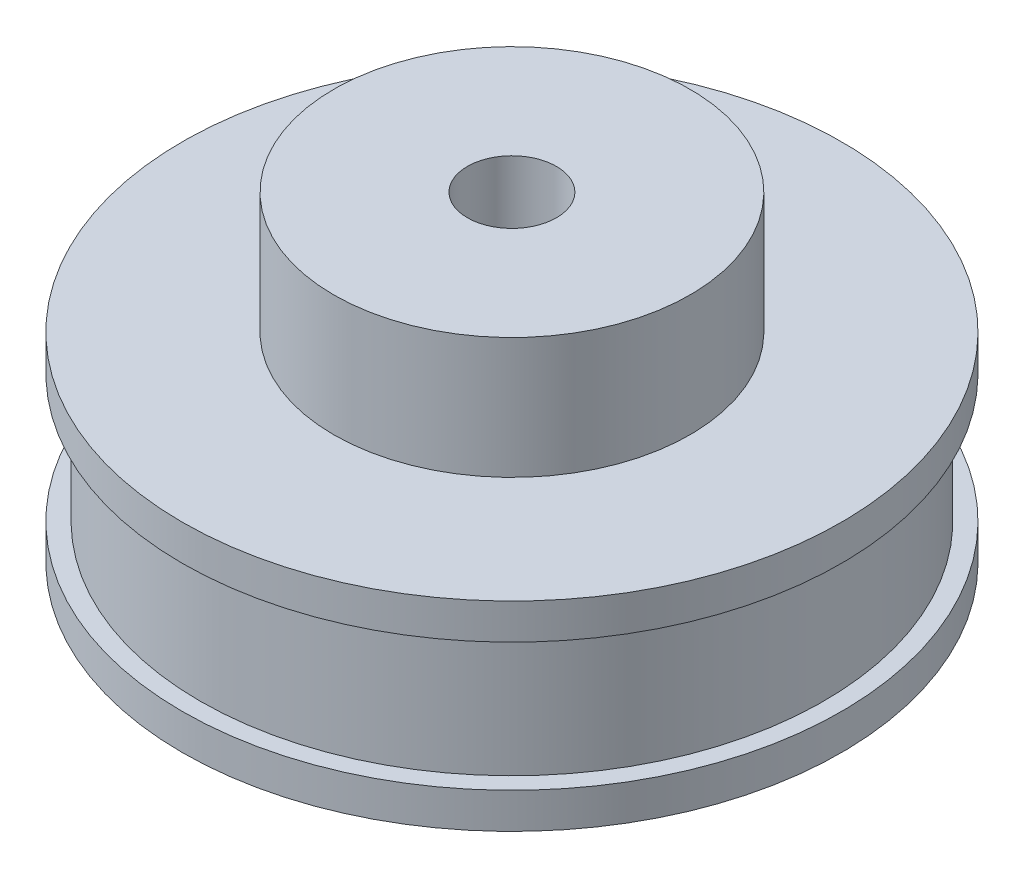
from build123d import *

# Parameters (mm, degrees)
SKIZZE1_R                       = 18.5
AUFSATZ_LINEAR_AUSTRAGEN1_DEPTH = 2
SKIZZE2_R                       = 17.5
AUFSATZ_LINEAR_AUSTRAGEN2_DEPTH = 7.2
SKIZZE3_R                       = 18.5
AUFSATZ_LINEAR_AUSTRAGEN3_DEPTH = 2
SKIZZE4_R                       = 10
AUFSATZ_LINEAR_AUSTRAGEN4_DEPTH = 6.8
SKIZZE5_R                       = 2.5
SCHNITT_LINEAR_AUSTRAGEN1_DEPTH = 32.756889016


with BuildPart() as part:
    # Skizze1 → Aufsatz-Linear austragen1 (new body)
    with BuildSketch(Plane(origin=(0, 0, 0), x_dir=(1, 0, 0), z_dir=(0, 1, 0))):
        with Locations(Location((0, 0, 0), (0, 0, 270))):
            Circle(SKIZZE1_R)
    extrude(amount=AUFSATZ_LINEAR_AUSTRAGEN1_DEPTH)

    # Skizze2 → Aufsatz-Linear austragen2 (add)
    with BuildSketch(Plane(origin=(0, 2, 0), x_dir=(1, 0, 0), z_dir=(0, 1, 0))):
        with Locations(Location((0, 0, 0), (0, 0, 270))):
            Circle(SKIZZE2_R)
    extrude(amount=AUFSATZ_LINEAR_AUSTRAGEN2_DEPTH)

    # Skizze3 → Aufsatz-Linear austragen3 (add)
    with BuildSketch(Plane(origin=(0, 9.2, 0), x_dir=(1, 0, 0), z_dir=(0, 1, 0))):
        with Locations(Location((0, 0, 0), (0, 0, 270))):
            Circle(SKIZZE3_R)
    extrude(amount=AUFSATZ_LINEAR_AUSTRAGEN3_DEPTH)

    # Skizze4 → Aufsatz-Linear austragen4 (add)
    with BuildSketch(Plane(origin=(0, 11.2, 0), x_dir=(1, 0, 0), z_dir=(0, 1, 0))):
        with Locations(Location((0, 0, 0), (0, 0, 270))):
            Circle(SKIZZE4_R)
    extrude(amount=AUFSATZ_LINEAR_AUSTRAGEN4_DEPTH)

    # Skizze5 → Schnitt-Linear austragen1 (cut, through all)
    with BuildSketch(Plane(origin=(0, 18, 0), x_dir=(1, 0, 0), z_dir=(0, 1, 0))):
        with Locations(Location((0, 0, 0), (0, 0, 270))):
            Circle(SKIZZE5_R)
    extrude(amount=-SCHNITT_LINEAR_AUSTRAGEN1_DEPTH, mode=Mode.SUBTRACT)


solid = part.part
